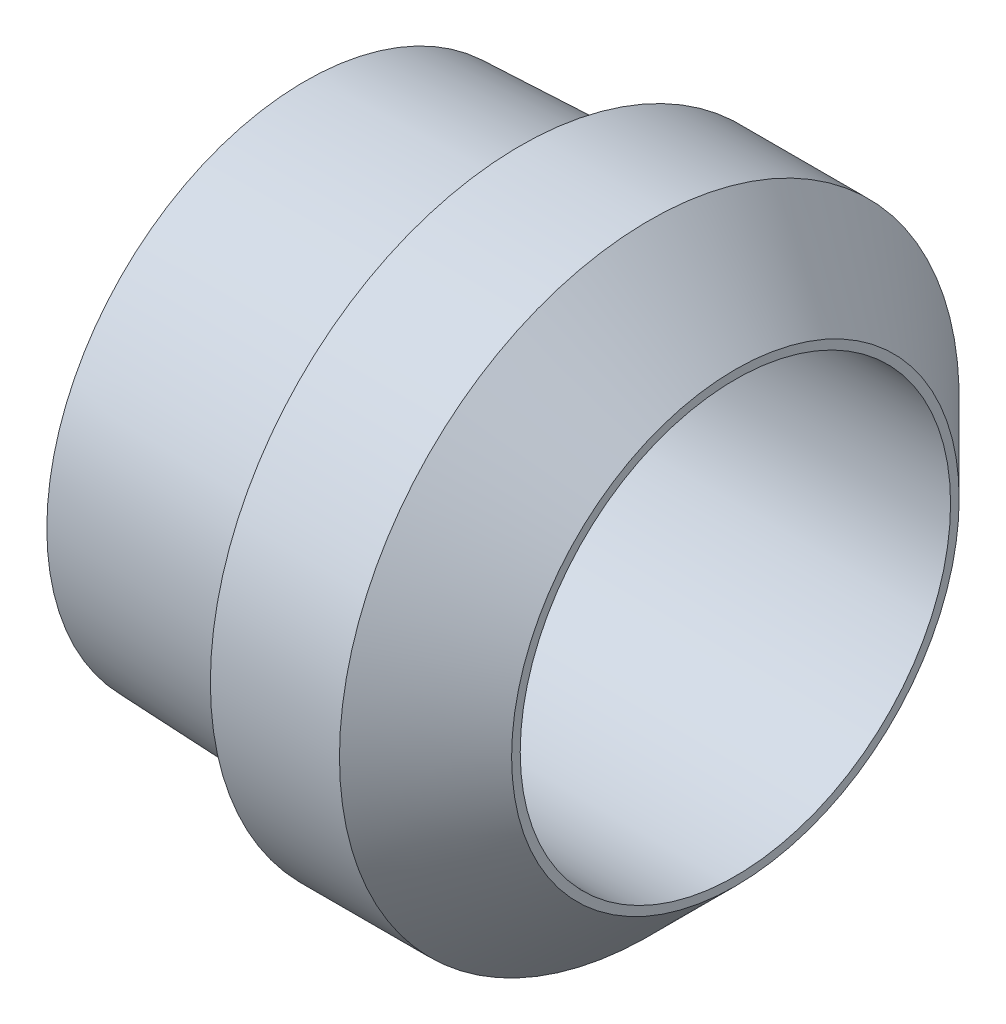
from build123d import *


with BuildPart() as part:
    # Sketch1 → Base-Revolve (revolve)
    with BuildSketch(Plane.XY, mode=Mode.PRIVATE) as base_revolve_sk:
        Polygon((0, 5), (0, 6), (5, 6.2), (5, 7.2), (8, 7.2), (10, 5.2), (10, 5), align=None)
    revolve(base_revolve_sk.sketch.rotate(Axis((-12, 0, 0), (1, 0, 0)), 90), axis=Axis((-12, 0, 0), (1, 0, 0)))


solid = part.part
